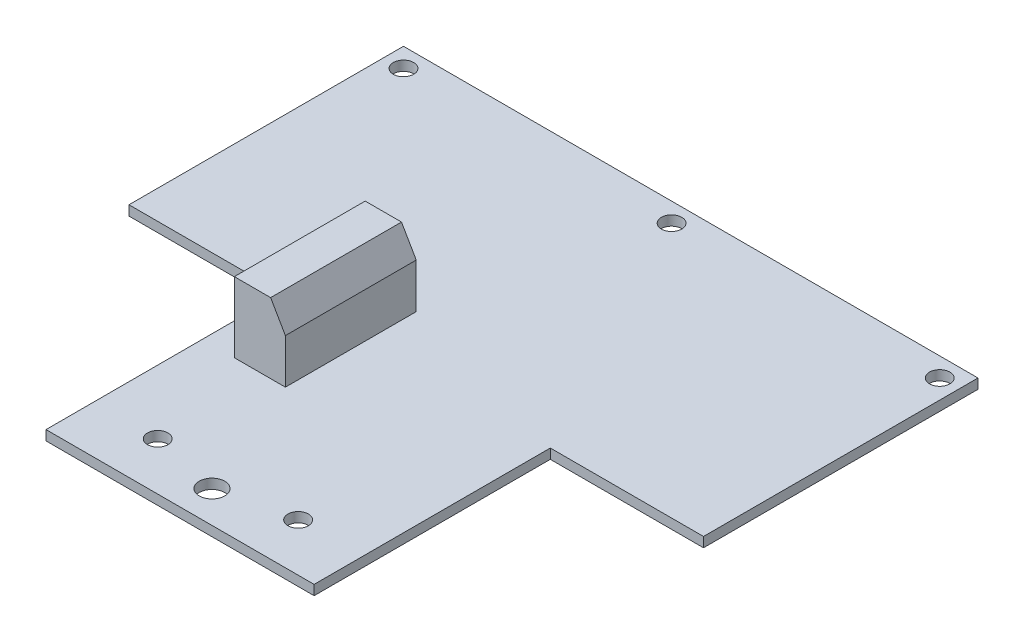
from build123d import *

# Parameters (mm, degrees)
SKETCH_1_R      = 1.6
SKETCH_1_R_2    = 2
EXTRUDE_1_DEPTH = 1.54
SKETCH_2_W      = 8
SKETCH_2_H      = 20.5
EXTRUDE_2_DEPTH = 11
CHAMFER_1_SIZE  = 4
CHAMFER_1_SIZE2 = 2.309401077


with BuildPart() as part:
    # Эскиз1 → Бобышка-Вытянуть1 (new body)
    with BuildSketch(Plane(origin=(0, 0, 0), x_dir=(1, 0, 0), z_dir=(0, 1, 0))):
        Polygon((-21, 0), (21, 0), (21, 37), (45, 37), (45, 80), (-45, 80), (-45, 37), (-21, 37), align=None)
        with Locations(Location((11, 7.5, 0), (0, 0, 270))):
            Circle(SKETCH_1_R, mode=Mode.SUBTRACT)
        with Locations(Location((42, 77, 0), (0, 0, 270))):
            Circle(SKETCH_1_R, mode=Mode.SUBTRACT)
        with Locations(Location((0, 77, 0), (0, 0, 270))):
            Circle(SKETCH_1_R, mode=Mode.SUBTRACT)
        with Locations(Location((0, 5, 0), (0, 0, 270))):
            Circle(SKETCH_1_R_2, mode=Mode.SUBTRACT)
        with Locations(Location((-42, 77, 0), (0, 0, 90))):
            Circle(SKETCH_1_R, mode=Mode.SUBTRACT)
        with Locations(Location((-11, 7.5, 0), (0, 0, 90))):
            Circle(SKETCH_1_R, mode=Mode.SUBTRACT)
    extrude(amount=EXTRUDE_1_DEPTH)

    # Эскиз2 → Бобышка-Вытянуть2 (add)
    with BuildSketch(Plane(origin=(0, 1.54, 0), x_dir=(1, 0, 0), z_dir=(0, 1, 0))):
        with Locations((-12, 34.75)):
            Rectangle(SKETCH_2_W, SKETCH_2_H)
    extrude(amount=EXTRUDE_2_DEPTH)

    # Фаска1
    chamfer_1_edges = [part.edges().sort_by_distance(p)[0] for p in [
        (-8, 12.54, -34.75),
    ]]
    chamfer_1_side = [part.faces().sort_by_distance(p)[0] for p in [
        (-8, 7.04, -34.75),
    ]]
    chamfer(chamfer_1_edges, length=CHAMFER_1_SIZE, length2=CHAMFER_1_SIZE2, reference=chamfer_1_side[0])


solid = part.part
